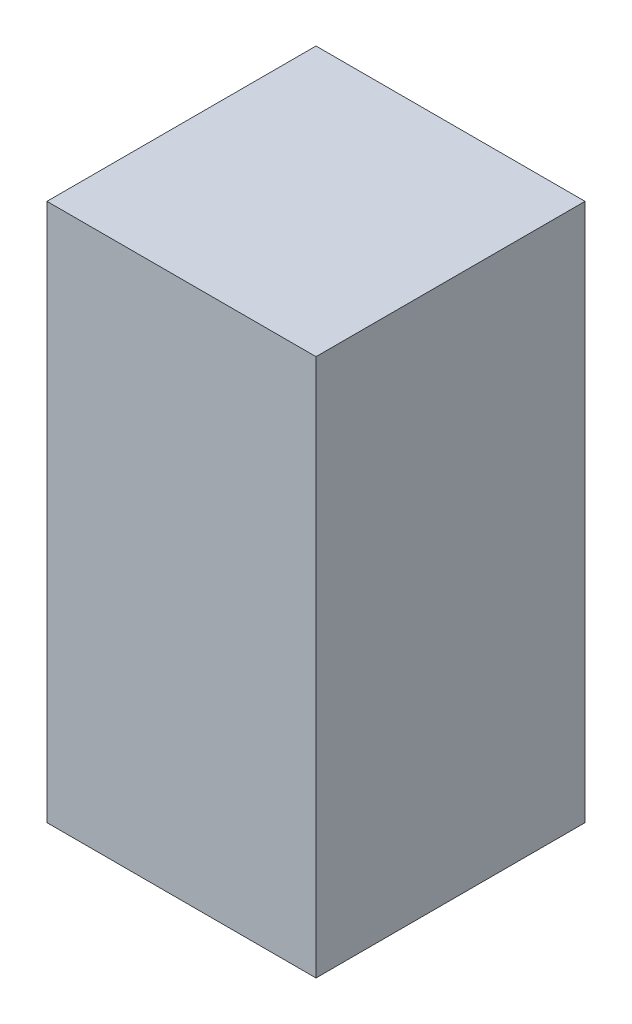
from build123d import *

# Parameters (mm, degrees)
SKETCH1_W           = 10
SKETCH1_H           = 20
BOSS_EXTRUDE1_DEPTH = 5


with BuildPart() as part:
    # Sketch1 → Boss-Extrude1 (new, symmetric)
    with BuildSketch(Plane.XY):
        Rectangle(SKETCH1_W, SKETCH1_H)
    extrude(amount=BOSS_EXTRUDE1_DEPTH, both=True)


solid = part.part
